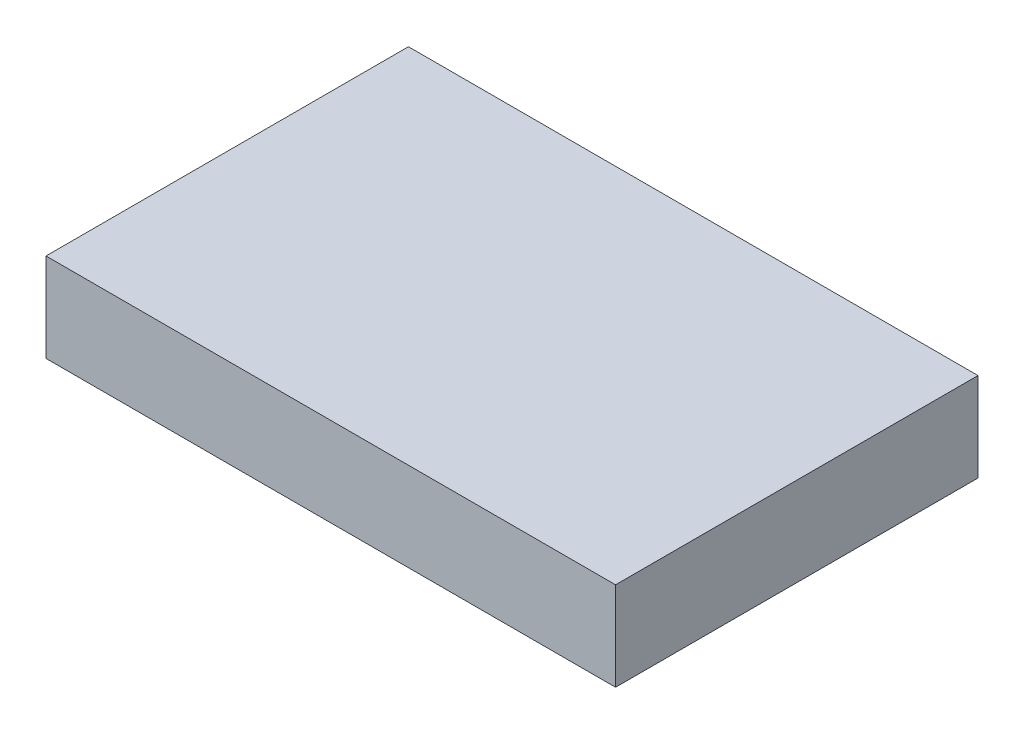
from build123d import *

# Parameters (mm, degrees)
ESBO_O1_W                = 77
ESBO_O1_H                = 49
RESSALTO_EXTRUS_O1_DEPTH = 12


with BuildPart() as part:
    # Esboço1 → Ressalto-extrusão1 (new body)
    with BuildSketch(Plane(origin=(0, 0, 0), x_dir=(1, 0, 0), z_dir=(0, 1, 0))):
        Rectangle(ESBO_O1_W, ESBO_O1_H)
    extrude(amount=RESSALTO_EXTRUS_O1_DEPTH)


solid = part.part
